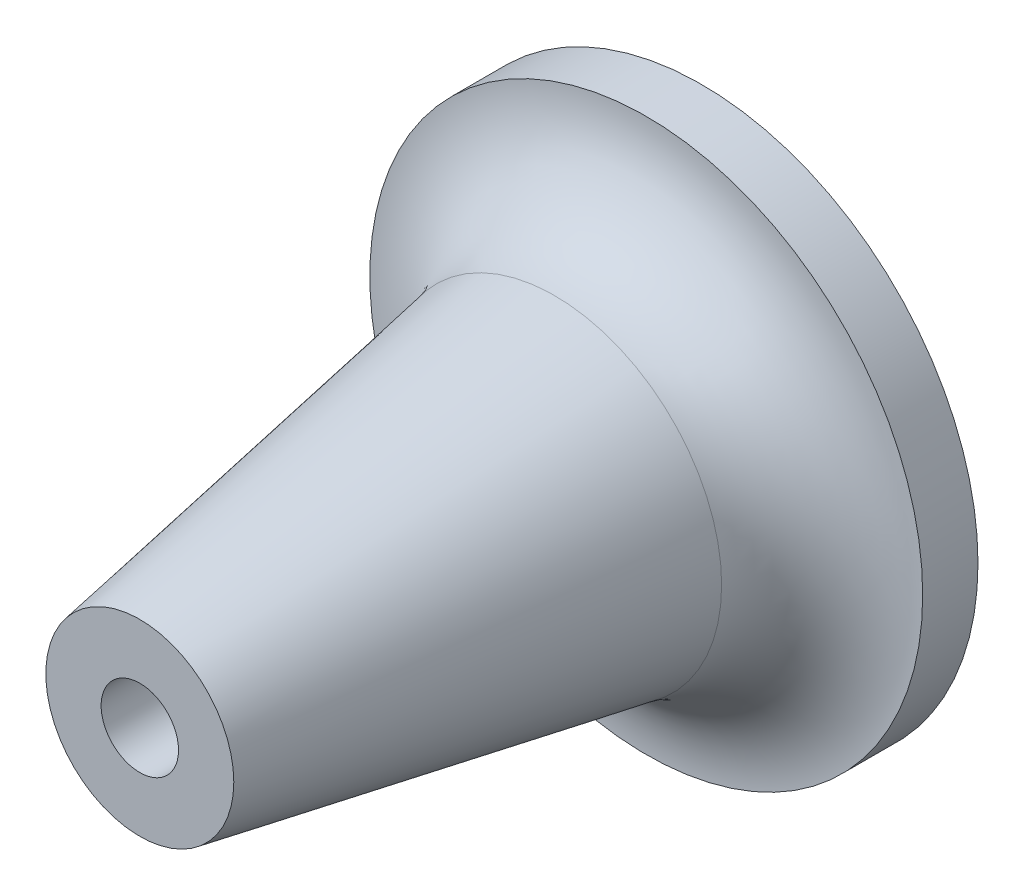
from build123d import *


with BuildPart() as part:
    # Sketch1 → Revolve1 (revolve)
    with BuildSketch(Plane(origin=(0, 0, 0), x_dir=(0, 0, -1), z_dir=(1, 0, 0)), mode=Mode.PRIVATE) as revolve1_sk:
        with BuildLine():
            Line((-33.715360463, 3.5), (8.084639537, 3.5))
            Line((8.084639537, 3.5), (8.084639537, 0))
            Line((8.084639537, 0), (8.284639537, 0))
            Line((8.284639537, 0), (8.284639537, 11.55))
            Line((8.284639537, 11.55), (17.084639537, 11.55))
            Line((17.084639537, 11.55), (17.084639537, 25))
            Line((17.084639537, 25), (12.084639537, 25))
            ThreePointArc((12.084639537, 25), (9.735819432, 18.5466698), (3.788398149, 15.112924521))
            Line((3.788398149, 15.112924521), (-33.715360463, 8.5))
            Line((-33.715360463, 8.5), (-33.715360463, 3.5))
        make_face()
    revolve(revolve1_sk.sketch.rotate(Axis((0, 0, 51.495497957), (0, 0, -1)), 90), axis=Axis((0, 0, 51.495497957), (0, 0, -1)))


solid = part.part
